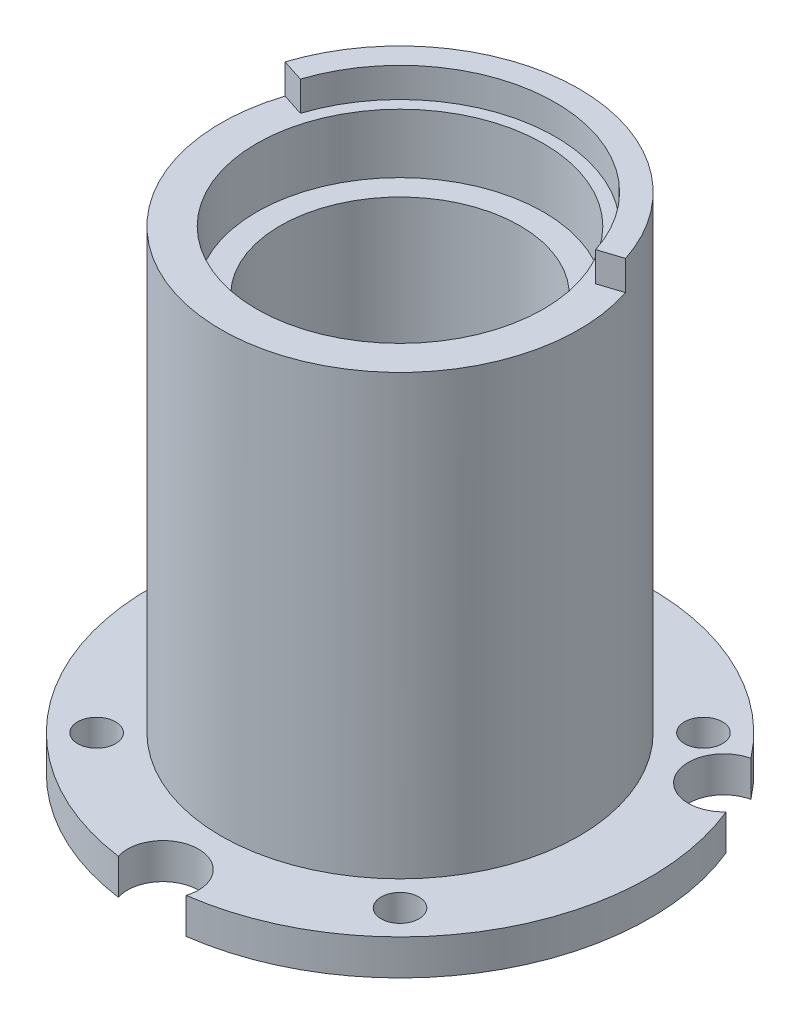
from build123d import *

# Parameters (mm, degrees)
SKETCH_2_R          = 21.1
SKETCH_2_R_2        = 15.1
SKETCH_2_R_3        = 1.6
EXTRUDE_1_DEPTH     = 3
SKETCH_4_R          = 3
CUT_EXTRUDE_1_DEPTH = 3
SKETCH_5_R          = 4
CUT_EXTRUDE_2_DEPTH = 42
EXTRUDE_4_DEPTH     = 2.5


with BuildPart() as part:
    # 草图1 → 旋转1 (revolve)
    with BuildSketch(Plane.XY, mode=Mode.PRIVATE) as revolve_1_sk:
        Polygon((12.1, -0.34341598), (12.1, 4.65658402), (10.1, 4.65658402), (10.1, 34.65658402), (12.1, 34.65658402), (12.1, 39.65658402), (15.1, 39.65658402), (15.1, -0.34341598), align=None)
    revolve(revolve_1_sk.sketch.rotate(Axis((0, 0, 0), (0, 1, 0)), 90), axis=Axis((0, 0, 0), (0, 1, 0)))

    # 草图2 → 凸台-拉伸1 (add)
    with BuildSketch(Plane.XZ.offset(0.34341598)):
        with Locations(Location((0, 0, 0), (0, 0, 270))):
            Circle(SKETCH_2_R)
        with Locations(Location((0, 0, 0), (0, 0, 270))):
            Circle(SKETCH_2_R_2, mode=Mode.SUBTRACT)
        with Locations(Location((-12.798632739, 12.798632739, 0), (0, 0, 270))):
            Circle(SKETCH_2_R_3, mode=Mode.SUBTRACT)
        with Locations(Location((12.798632739, 12.798632739, 0), (0, 0, 270))):
            Circle(SKETCH_2_R_3, mode=Mode.SUBTRACT)
        with Locations(Location((12.798632739, -12.798632739, 0), (0, 0, 270))):
            Circle(SKETCH_2_R_3, mode=Mode.SUBTRACT)
        with Locations(Location((-12.798632739, -12.798632739, 0), (0, 0, 270))):
            Circle(SKETCH_2_R_3, mode=Mode.SUBTRACT)
    extrude(amount=-EXTRUDE_1_DEPTH)

    # 草图4 → 切除-拉伸1 (cut)
    with BuildSketch(Plane.XZ.offset(0.34341598)):
        with Locations((0, 20)):
            Circle(SKETCH_4_R)
        with Locations((17.320508076, -10)):
            Circle(SKETCH_4_R)
        with Locations((-17.320508076, -10)):
            Circle(SKETCH_4_R)
    extrude(amount=-CUT_EXTRUDE_1_DEPTH, mode=Mode.SUBTRACT)

    # 草图5 → 切除-拉伸2 (cut)
    with BuildSketch(Plane.XY):
        with Locations(Location((0, 13.65658402, 0), (0, 0, 270))):
            Circle(SKETCH_5_R)
    extrude(amount=-CUT_EXTRUDE_2_DEPTH, mode=Mode.SUBTRACT)

    # 草图6 → 凸台-拉伸4 (add)
    with BuildSketch(Plane(origin=(0, 39.65658402, 0), x_dir=(1, 0, 0), z_dir=(0, 1, 0))):
        with BuildLine():
            Line((12.458840363, 4.048122626), (14.360953396, 4.666156615))
            ThreePointArc((14.360953396, 4.666156615), (0, 15.1), (-14.360953396, 4.666156615))
            Line((-14.360953396, 4.666156615), (-12.458840363, 4.048122626))
            ThreePointArc((-12.458840363, 4.048122626), (0, 13.1), (12.458840363, 4.048122626))
        make_face()
    extrude(amount=EXTRUDE_4_DEPTH)


solid = part.part
